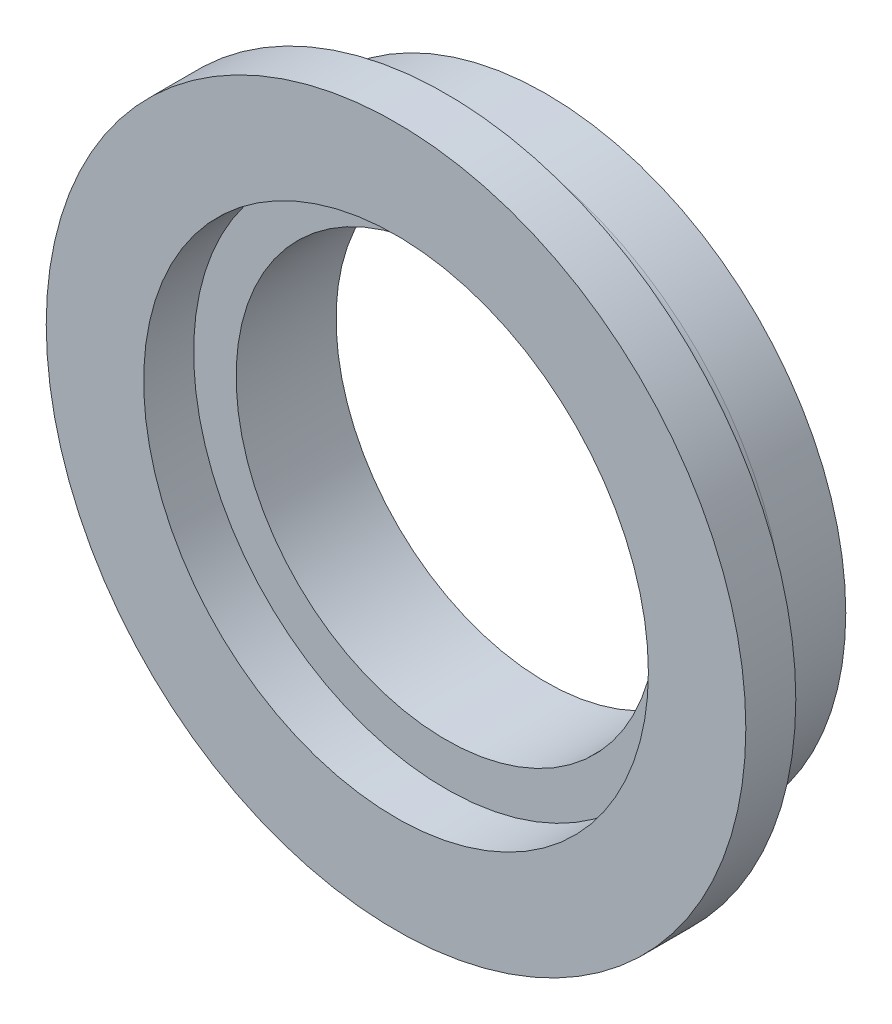
from build123d import *

# Parameters (mm, degrees)
SKETCH1_R           = 19.05
SKETCH1_R_2         = 13.335
BOSS_EXTRUDE1_DEPTH = 3.175
SKETCH2_R           = 22.225
SKETCH2_R_2         = 16.03375
BOSS_EXTRUDE2_DEPTH = 3.175
FILLET1_R           = 2.54


with BuildPart() as part:
    # Sketch1 → Boss-Extrude1 (new, symmetric)
    with BuildSketch(Plane.XY):
        Circle(SKETCH1_R)
        Circle(SKETCH1_R_2, mode=Mode.SUBTRACT)
    extrude(amount=BOSS_EXTRUDE1_DEPTH, both=True)

    # Sketch2 → Boss-Extrude2 (add)
    with BuildSketch(Plane.XY.offset(3.175)):
        Circle(SKETCH2_R)
        Circle(SKETCH2_R_2, mode=Mode.SUBTRACT)
    extrude(amount=BOSS_EXTRUDE2_DEPTH)

    # Fillet1
    fillet1_edges = [part.edges().sort_by_distance(p)[0] for p in [
        (-19.05, 0, 3.175),
    ]]
    fillet(fillet1_edges, radius=FILLET1_R)


solid = part.part
